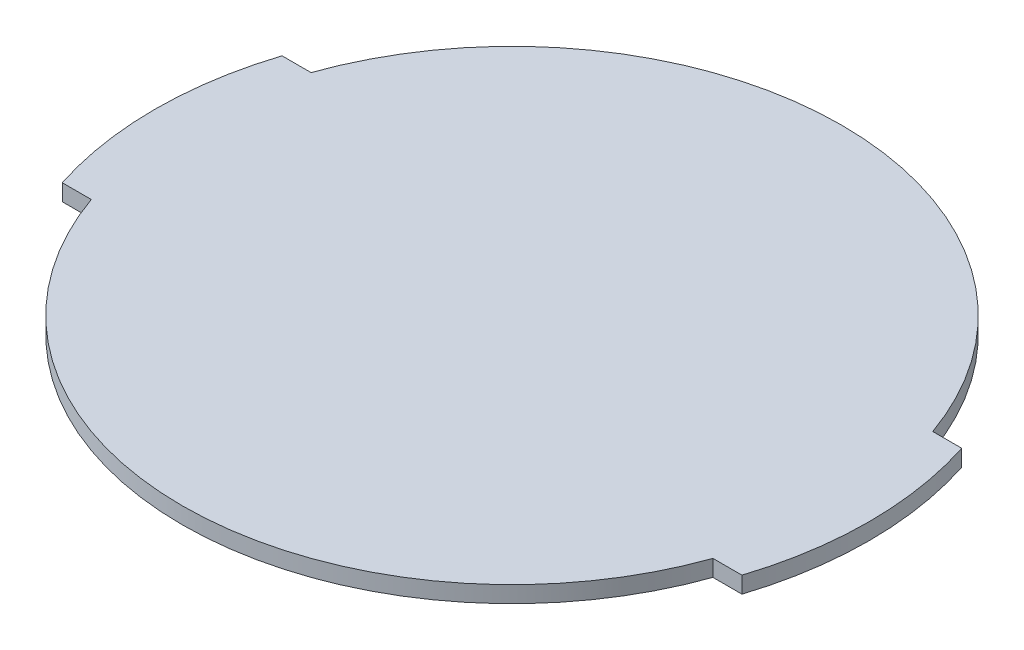
from build123d import *

# Parameters (mm, degrees)
BOSS_EXTRUDE1_DEPTH = 3


with BuildPart() as part:
    # Sketch1 → Boss-Extrude1 (new body)
    with BuildSketch(Plane(origin=(0, 0, 0), x_dir=(1, 0, 0), z_dir=(0, 1, 0))):
        with BuildLine():
            Line((-61.846584384, -20), (-56.568542495, -20))
            ThreePointArc((-56.568542495, -20), (0, -60), (56.568542495, -20))
            Line((56.568542495, -20), (61.846584384, -20))
            ThreePointArc((61.846584384, -20), (65, 0), (61.846584384, 20))
            Line((61.846584384, 20), (56.568542495, 20))
            ThreePointArc((56.568542495, 20), (0, 60), (-56.568542495, 20))
            Line((-56.568542495, 20), (-61.846584384, 20))
            ThreePointArc((-61.846584384, 20), (-65, 0), (-61.846584384, -20))
        make_face()
    extrude(amount=BOSS_EXTRUDE1_DEPTH)


solid = part.part
